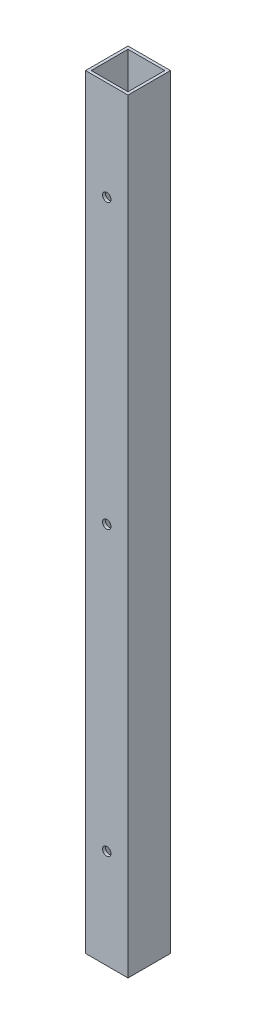
from build123d import *

# Parameters (mm, degrees)
SKETCH_1_W          = 15
SKETCH_1_H          = 15
SKETCH_1_W_2        = 13
SKETCH_1_H_2        = 13
EXTRUDE_1_DEPTH     = 270
SKETCH_2_R          = 1.5
CUT_EXTRUDE_1_DEPTH = 271.520331953


with BuildPart() as part:
    # 草图1 → 凸台-拉伸1 (new body)
    with BuildSketch(Plane(origin=(0, 0, 0), x_dir=(1, 0, 0), z_dir=(0, 1, 0))):
        Rectangle(SKETCH_1_W, SKETCH_1_H)
        Rectangle(SKETCH_1_W_2, SKETCH_1_H_2, mode=Mode.SUBTRACT)
    extrude(amount=EXTRUDE_1_DEPTH)

    # 草图2 → 切除-拉伸1 (cut, through all)
    with BuildSketch(Plane.XY.offset(7.5)):
        with Locations((0, 235)):
            Circle(SKETCH_2_R)
        with Locations((0, 35)):
            Circle(SKETCH_2_R)
        with Locations((0, 135)):
            Circle(SKETCH_2_R)
    extrude(amount=-CUT_EXTRUDE_1_DEPTH, mode=Mode.SUBTRACT)


solid = part.part
